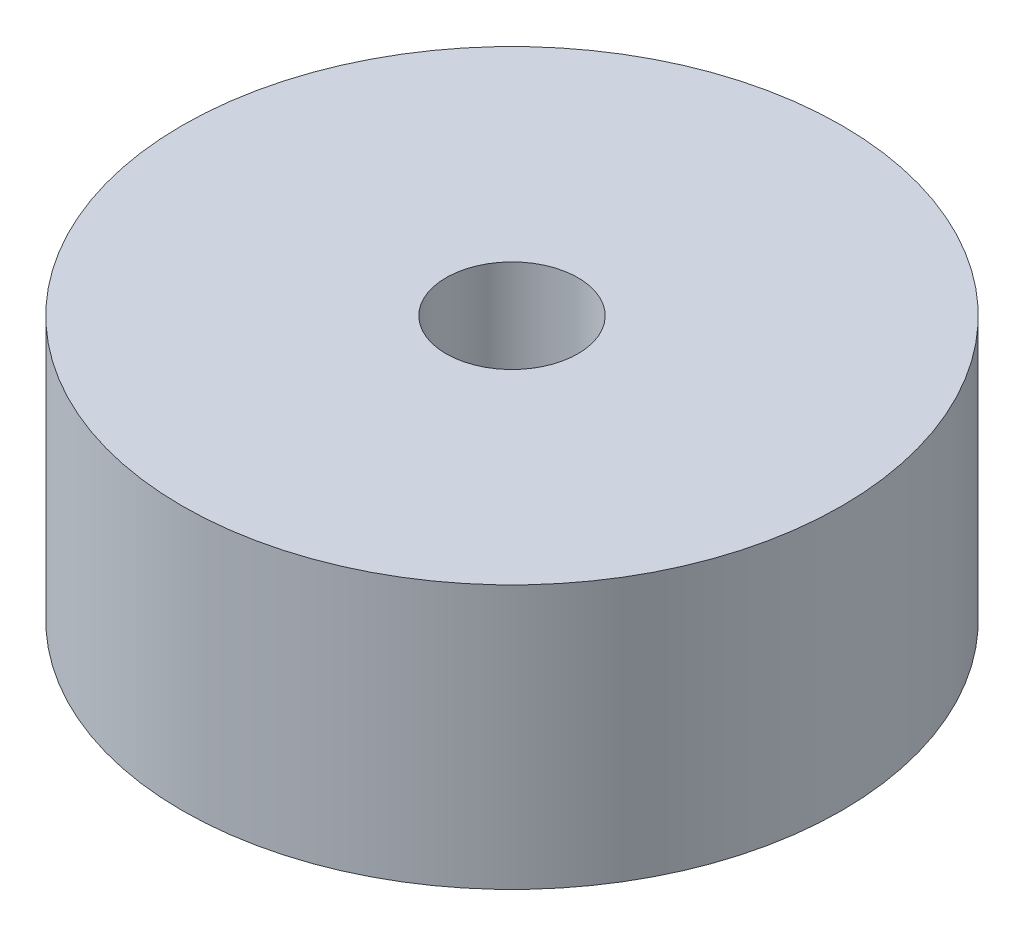
from build123d import *

# Parameters (mm, degrees)
SKETCH_1_R      = 2.5
SKETCH_1_R_2    = 0.5
EXTRUDE_1_DEPTH = 2


with BuildPart() as part:
    # 草圖1 → 伸長-薄件1 (new body)
    with BuildSketch(Plane(origin=(0, 0, 0), x_dir=(1, 0, 0), z_dir=(0, 1, 0))):
        Circle(SKETCH_1_R)
        Circle(SKETCH_1_R_2, mode=Mode.SUBTRACT)
    extrude(amount=EXTRUDE_1_DEPTH)


solid = part.part
